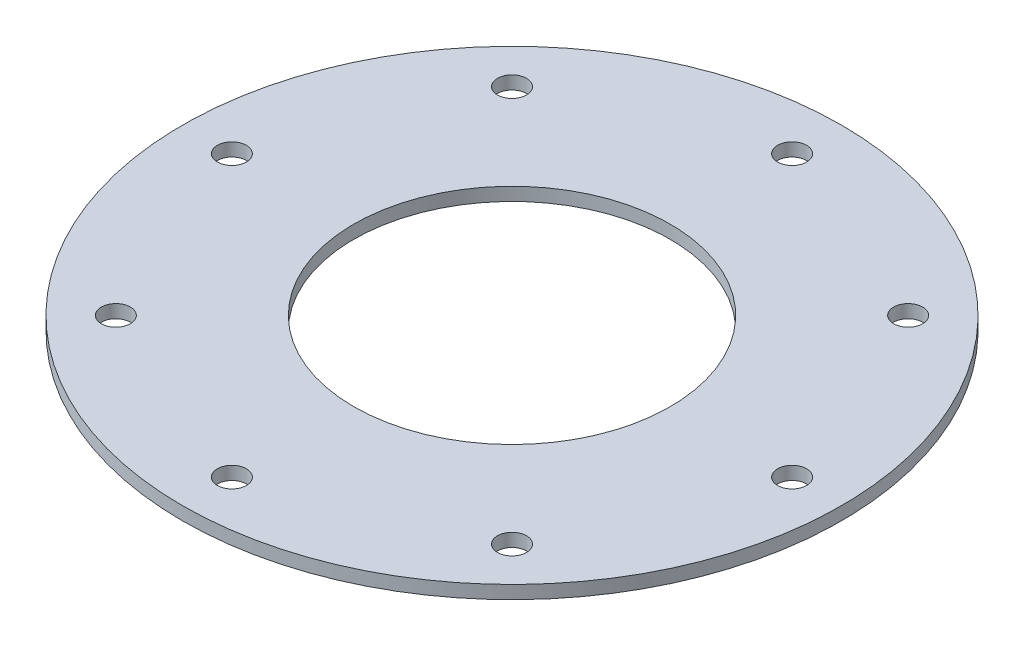
from build123d import *

# Parameters (mm, degrees)
SKETCH_1_R      = 100
SKETCH_1_R_2    = 48
SKETCH_1_R_3    = 4.4
EXTRUDE_1_DEPTH = 4


with BuildPart() as part:
    # Эскиз1 → Бобышка-Вытянуть1 (new body)
    with BuildSketch(Plane(origin=(0, 0, 0), x_dir=(1, 0, 0), z_dir=(0, 1, 0))):
        with Locations(Location((0, 0, 0), (0, 0, 270))):
            Circle(SKETCH_1_R)
        with Locations(Location((0, 0, 0), (0, 0, 270))):
            Circle(SKETCH_1_R_2, mode=Mode.SUBTRACT)
        with Locations(Location((85, 0, 0), (0, 0, 270))):
            Circle(SKETCH_1_R_3, mode=Mode.SUBTRACT)
        with Locations(Location((60.104076401, -60.104076401, 0), (0, 0, 270))):
            Circle(SKETCH_1_R_3, mode=Mode.SUBTRACT)
        with Locations(Location((0, -85, 0), (0, 0, 270))):
            Circle(SKETCH_1_R_3, mode=Mode.SUBTRACT)
        with Locations(Location((-60.104076401, -60.104076401, 0), (0, 0, 270))):
            Circle(SKETCH_1_R_3, mode=Mode.SUBTRACT)
        with Locations(Location((-85, 0, 0), (0, 0, 270))):
            Circle(SKETCH_1_R_3, mode=Mode.SUBTRACT)
        with Locations(Location((-60.104076401, 60.104076401, 0), (0, 0, 270))):
            Circle(SKETCH_1_R_3, mode=Mode.SUBTRACT)
        with Locations(Location((0, 85, 0), (0, 0, 270))):
            Circle(SKETCH_1_R_3, mode=Mode.SUBTRACT)
        with Locations(Location((60.104076401, 60.104076401, 0), (0, 0, 270))):
            Circle(SKETCH_1_R_3, mode=Mode.SUBTRACT)
    extrude(amount=EXTRUDE_1_DEPTH)


solid = part.part
